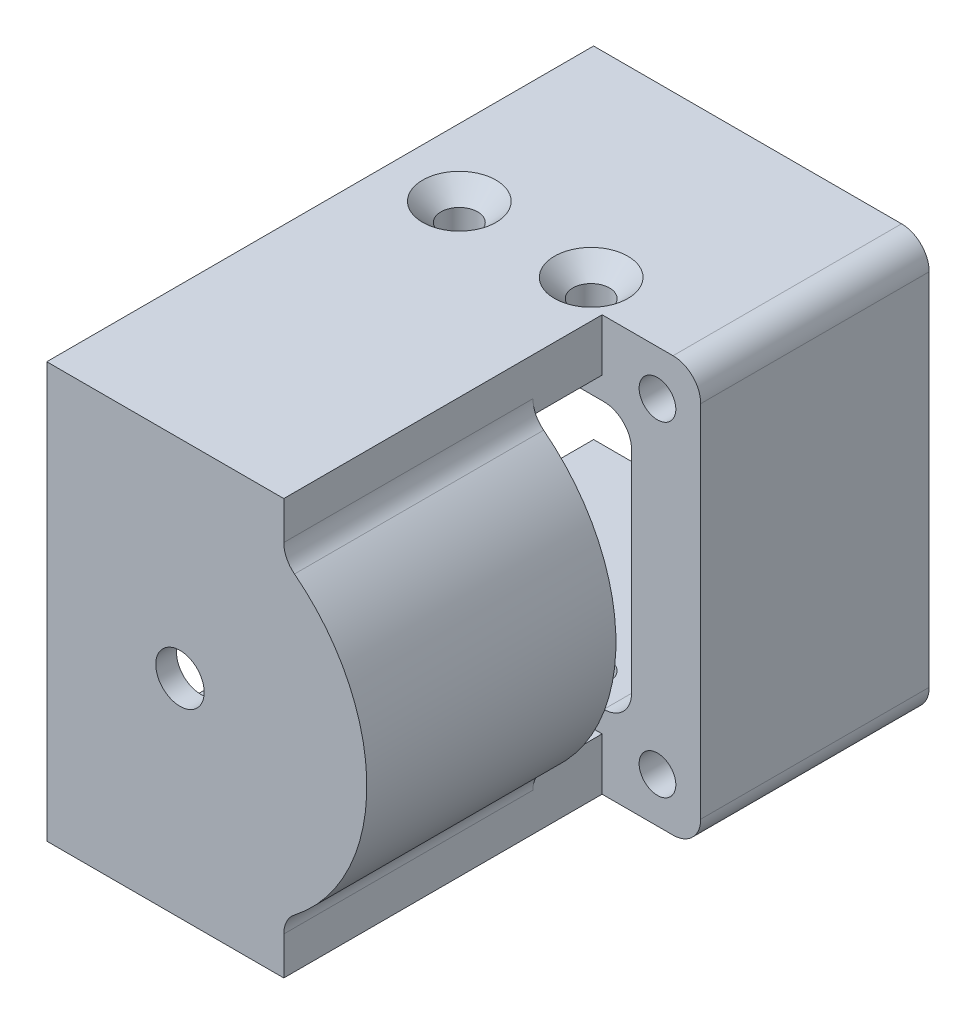
from build123d import *

# Parameters (mm, degrees)
BOSS_EXTRUDE1_DEPTH                             = 16.51
M5_CLEARANCE_HOLE1_D                            = 5.3
FILLET1_R                                       = 4
BOSS_EXTRUDE2_DEPTH                             = 43
CUT_EXTRUDE1_DEPTH                              = 83.423844244
CUT_EXTRUDE1_DEPTH_BACK                         = 83.423844244
SKETCH7_W                                       = 10
SKETCH7_H                                       = 44.899888642
FILLET2_R                                       = 4
BOSS_EXTRUDE3_START                             = 3
SKETCH8_R                                       = 3.5
BOSS_EXTRUDE3_DEPTH                             = 3
CSK_FOR_M5_FLAT_HEAD_MACHINE_SCREW1_D           = 5.3
CSK_FOR_M5_FLAT_HEAD_MACHINE_SCREW1_DEPTH       = 10.75
CSK_FOR_M5_FLAT_HEAD_MACHINE_SCREW1_CSINK_D     = 10.6
CSK_FOR_M5_FLAT_HEAD_MACHINE_SCREW1_CSINK_ANGLE = 90


with BuildPart() as part:
    # Sketch1 → Boss-Extrude1 (new, symmetric)
    with BuildSketch(Plane.XY):
        Polygon((-19.25, 19.25), (-19.25, 30), (29.25, 30), (29.25, -30), (-19.25, -30), (-19.25, -19.25), (19.25, -19.25), (19.25, 19.25), align=None)
    extrude(amount=BOSS_EXTRUDE1_DEPTH, both=True)

    # M5 Clearance Hole1 (through all)
    with Locations(Plane(origin=(0, 0, -16.51), x_dir=(-1, 0, 0), z_dir=(0, 0, -1))):
        with Locations((-23, -23.5), (-23, 23.5)):
            Hole(M5_CLEARANCE_HOLE1_D / 2)

    # Fillet1
    fillet1_edges = [part.edges().sort_by_distance(p)[0] for p in [
        (19.25, 19.25, 0),
        (29.25, 30, 0),
        (29.25, -30, 0),
        (19.25, -19.25, 0),
    ]]
    fillet(fillet1_edges, radius=FILLET1_R)

    # Sketch6 → Boss-Extrude2 (add)
    with BuildSketch(Plane.XY.offset(16.51)):
        with BuildLine():
            Line((-19.25, 22.5), (-19.25, 30))
            Line((-19.25, 30), (15, 30))
            Line((15, 30), (15, 22.449944321))
            ThreePointArc((15, 22.449944321), (27, 0), (15, -22.449944321))
            Line((15, -22.449944321), (15, -30))
            Line((15, -30), (-19.25, -30))
            Line((-19.25, -30), (-19.25, -22.5))
            Line((-19.25, -22.5), (0, -22.5))
            ThreePointArc((0, -22.5), (22.5, 0), (0, 22.5))
            Line((0, 22.5), (-19.25, 22.5))
        make_face()
    extrude(amount=BOSS_EXTRUDE2_DEPTH)

    # Sketch7 → Cut-Extrude1 (cut, two sides: drawn at the far end of the back side and taken through both)
    with BuildSketch(Plane(origin=(29.25, 0, 0), x_dir=(0, 0, -1), z_dir=(1, 0, 0)).offset(-CUT_EXTRUDE1_DEPTH_BACK)):
        with Locations((-21.51, 0)):
            Rectangle(SKETCH7_W, SKETCH7_H)
    extrude(amount=CUT_EXTRUDE1_DEPTH + CUT_EXTRUDE1_DEPTH_BACK, mode=Mode.SUBTRACT)

    # Fillet2
    fillet2_edges = [part.edges().sort_by_distance(p)[0] for p in [
        (15, -22.449944321, 43.01),
        (15, 22.449944321, 43.01),
    ]]
    fillet(fillet2_edges, radius=FILLET2_R)

    # Sketch8 → Boss-Extrude3 (add)
    with BuildSketch(Plane.XY.offset(59.51).offset(BOSS_EXTRUDE3_START)):
        with BuildLine():
            Line((-19.25, 22.5), (-19.25, -22.5))
            Line((-19.25, -22.5), (-19.25, -30))
            Line((-19.25, -30), (15, -30))
            Line((15, -30), (15, -24.494897428))
            ThreePointArc((15, -24.494897428), (15.407893959, -22.735132048), (16.548387097, -21.334265502))
            ThreePointArc((16.548387097, -21.334265502), (27, 0), (16.548387097, 21.334265502))
            ThreePointArc((16.548387097, 21.334265502), (15.407893959, 22.735132048), (15, 24.494897428))
            Line((15, 24.494897428), (15, 30))
            Line((15, 30), (-19.25, 30))
            Line((-19.25, 30), (-19.25, 22.5))
        make_face()
        Circle(SKETCH8_R, mode=Mode.SUBTRACT)
    extrude(amount=-BOSS_EXTRUDE3_DEPTH)

    # CSK for M5 Flat Head Machine Screw1
    with Locations(Plane(origin=(0, 30, 0), x_dir=(1, 0, 0), z_dir=(0, 1, 0))):
        with Locations((-9.525, -12.61625), (9.525, -12.61625)):
            csk_for_m5_flat_head_machine_screw1 = CounterSinkHole(CSK_FOR_M5_FLAT_HEAD_MACHINE_SCREW1_D / 2, CSK_FOR_M5_FLAT_HEAD_MACHINE_SCREW1_CSINK_D / 2, depth=CSK_FOR_M5_FLAT_HEAD_MACHINE_SCREW1_DEPTH, counter_sink_angle=CSK_FOR_M5_FLAT_HEAD_MACHINE_SCREW1_CSINK_ANGLE)

    # Mirror1: CSK for M5 Flat Head Machine Screw1 across plane
    add(csk_for_m5_flat_head_machine_screw1.mirror(Plane.ZX), mode=Mode.SUBTRACT)


solid = part.part
